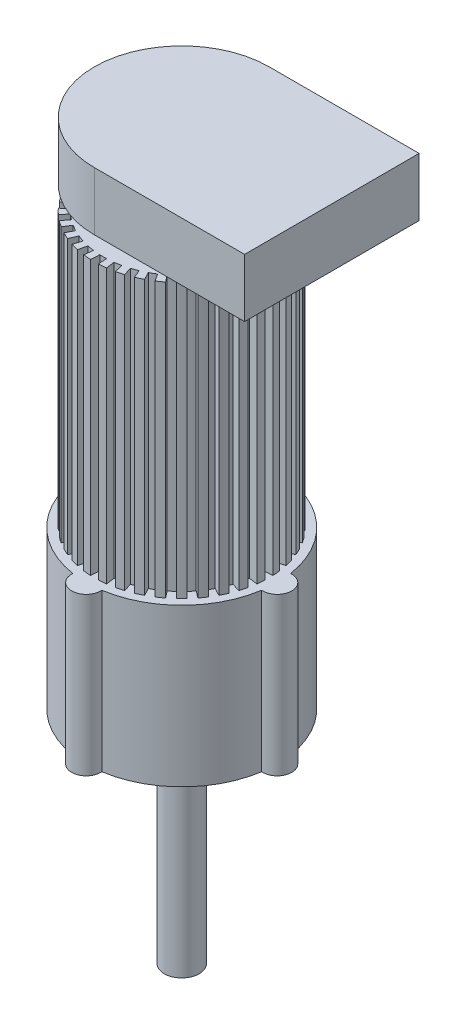
from build123d import *

# Parameters (mm, degrees)
SKETCH_1_R          = 8
EXTRUDE_1_DEPTH     = 3
EXTRUDE_2_DEPTH     = 27
SKETCH_3_R          = 15
EXTRUDE_4_DEPTH     = 47
SKETCH_4_R          = 11
EXTRUDE_5_DEPTH     = 10
SKETCH_7_R          = 3
EXTRUDE_7_DEPTH     = 34.9
SKETCH_10_R         = 1.5
CUT_EXTRUDE_3_DEPTH = 15
SKETCH_13_R         = 6.5
SKETCH_13_R_2       = 3
EXTRUDE_9_DEPTH     = 0.9
SKETCH_16_R         = 11
EXTRUDE_10_DEPTH    = 4
EXTRUDE_START       = -5
SKETCH_17_R         = 15
EXTRUDE_11_DEPTH    = 5
EXTRUDE_12_DEPTH    = 5
EXTRUDE_13_DEPTH    = 5
EXTRUDE_START_2     = -10
EXTRUDE_14_DEPTH    = 10
EXTRUDE_15_DEPTH    = 10
CUT_EXTRUDE_4_DEPTH = 10
CUT_EXTRUDE_5_DEPTH = 47


with BuildPart() as part:
    # 草图1 → 凸台-拉伸1 (new body)
    with BuildSketch(Plane(origin=(0, 0, 0), x_dir=(1, 0, 0), z_dir=(0, 1, 0))):
        with Locations(Location((0, 0, 0), (0, 0, 270))):
            Circle(SKETCH_1_R)
    extrude(amount=EXTRUDE_1_DEPTH)

    # 草图2 → 凸台-拉伸2 (add)
    with BuildSketch(Plane(origin=(0, 3, 0), x_dir=(1, 0, 0), z_dir=(0, 1, 0))):
        with BuildLine():
            ThreePointArc((16.20945122, -2.492727655), (18.9, 0), (16.20945122, 2.492727655))
            ThreePointArc((16.20945122, 2.492727655), (11.596551211, 11.596551211), (2.492727655, 16.20945122))
            ThreePointArc((2.492727655, 16.20945122), (0, 18.9), (-2.492727655, 16.20945122))
            ThreePointArc((-2.492727655, 16.20945122), (-11.596551211, 11.596551211), (-16.20945122, 2.492727655))
            ThreePointArc((-16.20945122, 2.492727655), (-18.9, 0), (-16.20945122, -2.492727655))
            ThreePointArc((-16.20945122, -2.492727655), (-11.596551211, -11.596551211), (-2.492727655, -16.20945122))
            ThreePointArc((-2.492727655, -16.20945122), (0, -18.9), (2.492727655, -16.20945122))
            ThreePointArc((2.492727655, -16.20945122), (11.596551211, -11.596551211), (16.20945122, -2.492727655))
        make_face()
    extrude(amount=EXTRUDE_2_DEPTH)

    # 草图3 → 凸台-拉伸4 (add)
    with BuildSketch(Plane(origin=(0, 30, 0), x_dir=(1, 0, 0), z_dir=(0, 1, 0))):
        with Locations(Location((0, 0, 0), (0, 0, 270))):
            Circle(SKETCH_3_R)
    extrude(amount=EXTRUDE_4_DEPTH)

    # 草图4 → 凸台-拉伸5 (add)
    with BuildSketch(Plane(origin=(0, 77, 0), x_dir=(1, 0, 0), z_dir=(0, 1, 0))):
        with Locations(Location((0, 0, 0), (0, 0, 270))):
            Circle(SKETCH_4_R)
    extrude(amount=EXTRUDE_5_DEPTH)

    # 草图7 → 凸台-拉伸7 (add)
    with BuildSketch(Plane.XZ):
        with Locations(Location((0, 0, 0), (0, 0, 270))):
            Circle(SKETCH_7_R)
    extrude(amount=EXTRUDE_7_DEPTH)

    # 草图10 → 切除-拉伸3 (cut)
    with BuildSketch(Plane.XZ.offset(-3)):
        with Locations(Location((-2.988584907, -11.153550717, 0), (0, 0, 270))):
            Circle(SKETCH_10_R)
        with Locations(Location((-8.164965809, 8.164965809, 0), (0, 0, 270))):
            Circle(SKETCH_10_R)
        with Locations(Location((11.153550717, 2.988584907, 0), (0, 0, 270))):
            Circle(SKETCH_10_R)
    extrude(amount=-CUT_EXTRUDE_3_DEPTH, mode=Mode.SUBTRACT)

    # 草图13 → 凸台-拉伸9 (add)
    with BuildSketch(Plane.XZ):
        with Locations(Location((0, 0, 0), (0, 0, 90))):
            Circle(SKETCH_13_R)
        with Locations(Location((0, 0, 0), (0, 0, 270))):
            Circle(SKETCH_13_R_2, mode=Mode.SUBTRACT)
    extrude(amount=EXTRUDE_9_DEPTH)

    # 草图16 → 凸台-拉伸10 (add)
    with BuildSketch(Plane(origin=(0, 87, 0), x_dir=(1, 0, 0), z_dir=(0, 1, 0))):
        with Locations(Location((0, 0, 0), (0, 0, 270))):
            Circle(SKETCH_16_R)
    extrude(amount=EXTRUDE_10_DEPTH)

    # 草图17 → 凸台-拉伸11 (add)
    with BuildSketch(Plane(origin=(0, 91, 0), x_dir=(1, 0, 0), z_dir=(0, 1, 0)).offset(EXTRUDE_START)):
        with Locations(Location((0, 0, 0), (0, 0, 270))):
            Circle(SKETCH_17_R)
    extrude(amount=EXTRUDE_11_DEPTH)

    # 草图18 → 凸台-拉伸12 (add)
    with BuildSketch(Plane.XZ.offset(-86)):
        with BuildLine():
            ThreePointArc((7.169204977, 13.175830145), (12.894535173, 7.6636129), (15, 0))
            Line((15, 0), (25.8, 0))
            Line((25.8, 0), (25.8, 14.75))
            Line((25.8, 14.75), (7.169204977, 14.75))
            Line((7.169204977, 14.75), (7.169204977, 13.175830145))
        make_face()
        with BuildLine():
            Line((25.8, 0), (15, 0))
            ThreePointArc((15, 0), (12.894535173, -7.6636129), (7.169204977, -13.175830145))
            Line((7.169204977, -13.175830145), (7.169204977, -14.75))
            Line((7.169204977, -14.75), (25.8, -14.75))
            Line((25.8, -14.75), (25.8, 0))
        make_face()
        with BuildLine():
            ThreePointArc((7.169204977, 8.342811277), (9.996530767, 4.590138628), (11, 0))
            Line((11, 0), (15, 0))
            ThreePointArc((15, 0), (12.894535173, 7.6636129), (7.169204977, 13.175830145))
            Line((7.169204977, 13.175830145), (7.169204977, 8.342811277))
        make_face()
        with BuildLine():
            Line((15, 0), (11, 0))
            ThreePointArc((11, 0), (9.996530767, -4.590138628), (7.169204977, -8.342811277))
            Line((7.169204977, -8.342811277), (7.169204977, -13.175830145))
            ThreePointArc((7.169204977, -13.175830145), (12.894535173, -7.6636129), (15, 0))
        make_face()
    extrude(amount=-EXTRUDE_12_DEPTH)

    # 草图19 → 凸台-拉伸13 (add)
    with BuildSketch(Plane(origin=(0, 91, 0), x_dir=(1, 0, 0), z_dir=(0, 1, 0)).offset(EXTRUDE_START)):
        with BuildLine():
            Line((0, 15), (25.763985811, 15))
            Line((25.763985811, 15), (25.8, 14.75))
            Line((25.8, 14.75), (7.169204977, 14.75))
            Line((7.169204977, 14.75), (7.169204977, 13.175830145))
            ThreePointArc((7.169204977, 13.175830145), (3.698820611, 14.536805911), (0, 15))
        make_face()
        with BuildLine():
            Line((0, -15), (25.8, -15))
            Line((25.8, -15), (25.8, -14.75))
            Line((25.8, -14.75), (7.169204977, -14.75))
            Line((7.169204977, -14.75), (7.169204977, -13.175830145))
            ThreePointArc((7.169204977, -13.175830145), (3.698820611, -14.536805911), (0, -15))
        make_face()
    extrude(amount=EXTRUDE_13_DEPTH)

    # 草图20 → 凸台-拉伸14 (add)
    with BuildSketch(Plane(origin=(0, 91, 0), x_dir=(1, 0, 0), z_dir=(0, 1, 0)).offset(EXTRUDE_START_2)):
        with BuildLine():
            Line((0, 15), (25.763985811, 15))
            Line((25.763985811, 15), (25.8, -15))
            Line((25.8, -15), (0, -15))
            ThreePointArc((0, -15), (-15, 0), (0, 15))
        make_face()
    extrude(amount=EXTRUDE_14_DEPTH)

    # 草图22 → 凸台-拉伸15 (add)
    with BuildSketch(Plane(origin=(0, 91, 0), x_dir=(1, 0, 0), z_dir=(0, 1, 0))):
        Polygon((25.763985811, 15), (25.8, -15), (19.341020596, -15), (19.341020596, 15), align=None)
    extrude(amount=-EXTRUDE_15_DEPTH)

    # 草图24 → 切除-拉伸4 (cut)
    with BuildSketch(Plane.XZ.offset(-81)):
        Polygon((25.8, 15), (25.763985811, -15), (34.708203337, -13.44419102), align=None)
    extrude(amount=-CUT_EXTRUDE_4_DEPTH, mode=Mode.SUBTRACT)

    # 草图25 → 切除-拉伸5 (cut)
    with BuildSketch(Plane(origin=(0, 30, 0), x_dir=(1, 0, 0), z_dir=(0, 1, 0))):
        with BuildLine():
            ThreePointArc((-9.131421435, 11.900300104), (-9.641814145, 11.490666647), (-10.133853114, 11.059160052))
            Line((-10.133853114, 11.059160052), (-9.120467803, 9.953244047))
            ThreePointArc((-9.120467803, 9.953244047), (-8.677632731, 10.341599982), (-8.218279292, 10.710270094))
            Line((-8.218279292, 10.710270094), (-9.131421435, 11.900300104))
        make_face()
        with BuildLine():
            ThreePointArc((-11.059160052, 10.133853114), (-11.490666647, 9.641814145), (-11.900300104, 9.131421435))
            Line((-11.900300104, 9.131421435), (-10.710270094, 8.218279292))
            ThreePointArc((-10.710270094, 8.218279292), (-10.341599982, 8.677632731), (-9.953244047, 9.120467803))
            Line((-9.953244047, 9.120467803), (-11.059160052, 10.133853114))
        make_face()
        with BuildLine():
            ThreePointArc((-12.650871687, 8.059494125), (-12.990381057, 7.5), (-13.305162498, 6.926229199))
            Line((-13.305162498, 6.926229199), (-11.974646248, 6.233606279))
            ThreePointArc((-11.974646248, 6.233606279), (-11.691342951, 6.75), (-11.385784518, 7.253544713))
            Line((-11.385784518, 7.253544713), (-12.650871687, 8.059494125))
        make_face()
        with BuildLine():
            ThreePointArc((-14.644440107, 3.246594209), (-14.772116295, 2.604722665), (-14.871672921, 1.957892883))
            Line((-14.871672921, 1.957892883), (-13.384505629, 1.762103595))
            ThreePointArc((-13.384505629, 1.762103595), (-13.294904666, 2.344250399), (-13.179996096, 2.921934788))
            Line((-13.179996096, 2.921934788), (-14.644440107, 3.246594209))
        make_face()
        with BuildLine():
            ThreePointArc((-14.871672921, -1.957892883), (-14.772116295, -2.604722665), (-14.644440107, -3.246594209))
            Line((-14.644440107, -3.246594209), (-13.179996096, -2.921934788))
            ThreePointArc((-13.179996096, -2.921934788), (-13.294904666, -2.344250399), (-13.384505629, -1.762103595))
            Line((-13.384505629, -1.762103595), (-14.871672921, -1.957892883))
        make_face()
        with BuildLine():
            ThreePointArc((-14.305754261, -4.510586993), (-14.095389312, -5.13030215), (-13.858192988, -5.740251485))
            Line((-13.858192988, -5.740251485), (-12.472373689, -5.166226337))
            ThreePointArc((-12.472373689, -5.166226337), (-12.685850381, -4.617271935), (-12.875178835, -4.059528293))
            Line((-12.875178835, -4.059528293), (-14.305754261, -4.510586993))
        make_face()
        with BuildLine():
            ThreePointArc((-13.305162498, -6.926229199), (-12.990381057, -7.5), (-12.650871687, -8.059494125))
            Line((-12.650871687, -8.059494125), (-11.385784518, -7.253544713))
            ThreePointArc((-11.385784518, -7.253544713), (-11.691342951, -6.75), (-11.974646248, -6.233606279))
            Line((-11.974646248, -6.233606279), (-13.305162498, -6.926229199))
        make_face()
        with BuildLine():
            ThreePointArc((-10.133853114, -11.059160052), (-9.641814145, -11.490666647), (-9.131421435, -11.900300104))
            Line((-9.131421435, -11.900300104), (-8.218279292, -10.710270094))
            ThreePointArc((-8.218279292, -10.710270094), (-8.677632731, -10.341599982), (-9.120467803, -9.953244047))
            Line((-9.120467803, -9.953244047), (-10.133853114, -11.059160052))
        make_face()
        with BuildLine():
            ThreePointArc((0.588861729, -13.487150991), (0, -13.5), (-0.588861729, -13.487150991))
            Line((-0.588861729, -13.487150991), (-0.65429081, -14.985723324))
            ThreePointArc((-0.65429081, -14.985723324), (0, -15), (0.65429081, -14.985723324))
            Line((0.65429081, -14.985723324), (0.588861729, -13.487150991))
        make_face()
        with BuildLine():
            Line((1.762103595, -13.384505629), (1.957892883, -14.871672921))
            ThreePointArc((1.957892883, -14.871672921), (2.281850793, -14.825422657), (2.604722665, -14.772116295))
            Line((2.604722665, -14.772116295), (2.344250399, -13.294904666))
            ThreePointArc((2.344250399, -13.294904666), (2.053665714, -13.342880391), (1.762103595, -13.384505629))
        make_face()
        with BuildLine():
            Line((2.344250399, -13.294904666), (2.604722665, -14.772116295))
            ThreePointArc((2.604722665, -14.772116295), (2.92635483, -14.711779206), (3.246594209, -14.644440107))
            Line((3.246594209, -14.644440107), (2.921934788, -13.179996096))
            ThreePointArc((2.921934788, -13.179996096), (2.633719347, -13.240601285), (2.344250399, -13.294904666))
        make_face()
        with BuildLine():
            Line((4.059528293, -12.875178835), (4.510586993, -14.305754261))
            ThreePointArc((4.510586993, -14.305754261), (5.13030215, -14.095389312), (5.740251485, -13.858192988))
            Line((5.740251485, -13.858192988), (5.166226337, -12.472373689))
            ThreePointArc((5.166226337, -12.472373689), (4.617271935, -12.685850381), (4.059528293, -12.875178835))
        make_face()
        with BuildLine():
            Line((6.233606279, -11.974646248), (6.926229199, -13.305162498))
            ThreePointArc((6.926229199, -13.305162498), (7.5, -12.990381057), (8.059494125, -12.650871687))
            Line((8.059494125, -12.650871687), (7.253544713, -11.385784518))
            ThreePointArc((7.253544713, -11.385784518), (6.75, -11.691342951), (6.233606279, -11.974646248))
        make_face()
        with BuildLine():
            Line((8.218279292, -10.710270094), (9.131421435, -11.900300104))
            ThreePointArc((9.131421435, -11.900300104), (9.641814145, -11.490666647), (10.133853114, -11.059160052))
            Line((10.133853114, -11.059160052), (9.120467803, -9.953244047))
            ThreePointArc((9.120467803, -9.953244047), (8.677632731, -10.341599982), (8.218279292, -10.710270094))
        make_face()
        with BuildLine():
            Line((9.953244047, -9.120467803), (11.059160052, -10.133853114))
            ThreePointArc((11.059160052, -10.133853114), (11.490666647, -9.641814145), (11.900300104, -9.131421435))
            Line((11.900300104, -9.131421435), (10.710270094, -8.218279292))
            ThreePointArc((10.710270094, -8.218279292), (10.341599982, -8.677632731), (9.953244047, -9.120467803))
        make_face()
        with BuildLine():
            Line((11.385784518, -7.253544713), (12.650871687, -8.059494125))
            ThreePointArc((12.650871687, -8.059494125), (12.990381057, -7.5), (13.305162498, -6.926229199))
            Line((13.305162498, -6.926229199), (11.974646248, -6.233606279))
            ThreePointArc((11.974646248, -6.233606279), (11.691342951, -6.75), (11.385784518, -7.253544713))
        make_face()
        with BuildLine():
            Line((12.472373689, -5.166226337), (13.858192988, -5.740251485))
            ThreePointArc((13.858192988, -5.740251485), (14.095389312, -5.13030215), (14.305754261, -4.510586993))
            Line((14.305754261, -4.510586993), (12.875178835, -4.059528293))
            ThreePointArc((12.875178835, -4.059528293), (12.685850381, -4.617271935), (12.472373689, -5.166226337))
        make_face()
        with BuildLine():
            Line((13.179996096, -2.921934788), (14.644440107, -3.246594209))
            ThreePointArc((14.644440107, -3.246594209), (14.772116295, -2.604722665), (14.871672921, -1.957892883))
            Line((14.871672921, -1.957892883), (13.384505629, -1.762103595))
            ThreePointArc((13.384505629, -1.762103595), (13.294904666, -2.344250399), (13.179996096, -2.921934788))
        make_face()
        with BuildLine():
            Line((13.487150991, -0.588861729), (14.985723324, -0.65429081))
            ThreePointArc((14.985723324, -0.65429081), (14.996430406, -0.327223276), (15, 0))
            ThreePointArc((15, 0), (14.996430406, 0.327223276), (14.985723324, 0.65429081))
            Line((14.985723324, 0.65429081), (13.487150991, 0.588861729))
            ThreePointArc((13.487150991, 0.588861729), (13.5, 0), (13.487150991, -0.588861729))
        make_face()
        with BuildLine():
            Line((13.384505629, 1.762103595), (14.871672921, 1.957892883))
            ThreePointArc((14.871672921, 1.957892883), (14.772116295, 2.604722665), (14.644440107, 3.246594209))
            Line((14.644440107, 3.246594209), (13.179996096, 2.921934788))
            ThreePointArc((13.179996096, 2.921934788), (13.294904666, 2.344250399), (13.384505629, 1.762103595))
        make_face()
        with BuildLine():
            Line((12.875178835, 4.059528293), (14.305754261, 4.510586993))
            ThreePointArc((14.305754261, 4.510586993), (14.095389312, 5.13030215), (13.858192988, 5.740251485))
            Line((13.858192988, 5.740251485), (12.472373689, 5.166226337))
            ThreePointArc((12.472373689, 5.166226337), (12.685850381, 4.617271935), (12.875178835, 4.059528293))
        make_face()
        with BuildLine():
            Line((11.974646248, 6.233606279), (13.305162498, 6.926229199))
            ThreePointArc((13.305162498, 6.926229199), (12.990381057, 7.5), (12.650871687, 8.059494125))
            Line((12.650871687, 8.059494125), (11.385784518, 7.253544713))
            ThreePointArc((11.385784518, 7.253544713), (11.691342951, 6.75), (11.974646248, 6.233606279))
        make_face()
        with BuildLine():
            Line((10.710270094, 8.218279292), (11.900300104, 9.131421435))
            ThreePointArc((11.900300104, 9.131421435), (11.490666647, 9.641814145), (11.059160052, 10.133853114))
            Line((11.059160052, 10.133853114), (9.953244047, 9.120467803))
            ThreePointArc((9.953244047, 9.120467803), (10.341599982, 8.677632731), (10.710270094, 8.218279292))
        make_face()
        with BuildLine():
            Line((9.120467803, 9.953244047), (10.133853114, 11.059160052))
            ThreePointArc((10.133853114, 11.059160052), (9.641814145, 11.490666647), (9.131421435, 11.900300104))
            Line((9.131421435, 11.900300104), (8.218279292, 10.710270094))
            ThreePointArc((8.218279292, 10.710270094), (8.677632731, 10.341599982), (9.120467803, 9.953244047))
        make_face()
        with BuildLine():
            Line((7.253544713, 11.385784518), (8.059494125, 12.650871687))
            ThreePointArc((8.059494125, 12.650871687), (7.5, 12.990381057), (6.926229199, 13.305162498))
            Line((6.926229199, 13.305162498), (6.233606279, 11.974646248))
            ThreePointArc((6.233606279, 11.974646248), (6.75, 11.691342951), (7.253544713, 11.385784518))
        make_face()
        with BuildLine():
            Line((5.166226337, 12.472373689), (5.740251485, 13.858192988))
            ThreePointArc((5.740251485, 13.858192988), (5.13030215, 14.095389312), (4.510586993, 14.305754261))
            Line((4.510586993, 14.305754261), (4.059528293, 12.875178835))
            ThreePointArc((4.059528293, 12.875178835), (4.617271935, 12.685850381), (5.166226337, 12.472373689))
        make_face()
        with BuildLine():
            ThreePointArc((-6.926229199, 13.305162498), (-7.5, 12.990381057), (-8.059494125, 12.650871687))
            Line((-8.059494125, 12.650871687), (-7.253544713, 11.385784518))
            ThreePointArc((-7.253544713, 11.385784518), (-6.75, 11.691342951), (-6.233606279, 11.974646248))
            Line((-6.233606279, 11.974646248), (-6.926229199, 13.305162498))
        make_face()
        with BuildLine():
            ThreePointArc((-4.510586993, 14.305754261), (-5.13030215, 14.095389312), (-5.740251485, 13.858192988))
            Line((-5.740251485, 13.858192988), (-5.166226337, 12.472373689))
            ThreePointArc((-5.166226337, 12.472373689), (-4.617271935, 12.685850381), (-4.059528293, 12.875178835))
            Line((-4.059528293, 12.875178835), (-4.510586993, 14.305754261))
        make_face()
        with BuildLine():
            ThreePointArc((-1.957892883, 14.871672921), (-2.604722665, 14.772116295), (-3.246594209, 14.644440107))
            Line((-3.246594209, 14.644440107), (-2.921934788, 13.179996096))
            ThreePointArc((-2.921934788, 13.179996096), (-2.344250399, 13.294904666), (-1.762103595, 13.384505629))
            Line((-1.762103595, 13.384505629), (-1.957892883, 14.871672921))
        make_face()
        with BuildLine():
            ThreePointArc((0.65429081, 14.985723324), (0, 15), (-0.65429081, 14.985723324))
            Line((-0.65429081, 14.985723324), (-0.588861729, 13.487150991))
            ThreePointArc((-0.588861729, 13.487150991), (0, 13.5), (0.588861729, 13.487150991))
            Line((0.588861729, 13.487150991), (0.65429081, 14.985723324))
        make_face()
        with BuildLine():
            Line((-12.875178835, 4.059528293), (-14.305754261, 4.510586993))
            ThreePointArc((-14.305754261, 4.510586993), (-14.095389312, 5.13030215), (-13.858192988, 5.740251485))
            Line((-13.858192988, 5.740251485), (-12.472373689, 5.166226337))
            ThreePointArc((-12.472373689, 5.166226337), (-12.685850381, 4.617271935), (-12.875178835, 4.059528293))
        make_face()
        with BuildLine():
            Line((-13.487150991, 0.588861729), (-14.985723324, 0.65429081))
            ThreePointArc((-14.985723324, 0.65429081), (-15, 0), (-14.985723324, -0.65429081))
            Line((-14.985723324, -0.65429081), (-13.487150991, -0.588861729))
            ThreePointArc((-13.487150991, -0.588861729), (-13.5, 0), (-13.487150991, 0.588861729))
        make_face()
        with BuildLine():
            Line((-9.953244047, -9.120467803), (-11.059160052, -10.133853114))
            ThreePointArc((-11.059160052, -10.133853114), (-11.490666647, -9.641814145), (-11.900300104, -9.131421435))
            Line((-11.900300104, -9.131421435), (-10.710270094, -8.218279292))
            ThreePointArc((-10.710270094, -8.218279292), (-10.341599982, -8.677632731), (-9.953244047, -9.120467803))
        make_face()
        with BuildLine():
            Line((-6.233606279, -11.974646248), (-6.926229199, -13.305162498))
            ThreePointArc((-6.926229199, -13.305162498), (-7.5, -12.990381057), (-8.059494125, -12.650871687))
            Line((-8.059494125, -12.650871687), (-7.253544713, -11.385784518))
            ThreePointArc((-7.253544713, -11.385784518), (-6.75, -11.691342951), (-6.233606279, -11.974646248))
        make_face()
        with BuildLine():
            Line((-4.059528293, -12.875178835), (-4.510586993, -14.305754261))
            ThreePointArc((-4.510586993, -14.305754261), (-5.13030215, -14.095389312), (-5.740251485, -13.858192988))
            Line((-5.740251485, -13.858192988), (-5.166226337, -12.472373689))
            ThreePointArc((-5.166226337, -12.472373689), (-4.617271935, -12.685850381), (-4.059528293, -12.875178835))
        make_face()
        with BuildLine():
            Line((-1.762103595, -13.384505629), (-1.957892883, -14.871672921))
            ThreePointArc((-1.957892883, -14.871672921), (-2.604722665, -14.772116295), (-3.246594209, -14.644440107))
            Line((-3.246594209, -14.644440107), (-2.921934788, -13.179996096))
            ThreePointArc((-2.921934788, -13.179996096), (-2.344250399, -13.294904666), (-1.762103595, -13.384505629))
        make_face()
        with BuildLine():
            Line((1.762103595, 13.384505629), (1.957892883, 14.871672921))
            ThreePointArc((1.957892883, 14.871672921), (2.604722665, 14.772116295), (3.246594209, 14.644440107))
            Line((3.246594209, 14.644440107), (2.921934788, 13.179996096))
            ThreePointArc((2.921934788, 13.179996096), (2.344250399, 13.294904666), (1.762103595, 13.384505629))
        make_face()
    extrude(amount=CUT_EXTRUDE_5_DEPTH, mode=Mode.SUBTRACT)


solid = part.part
